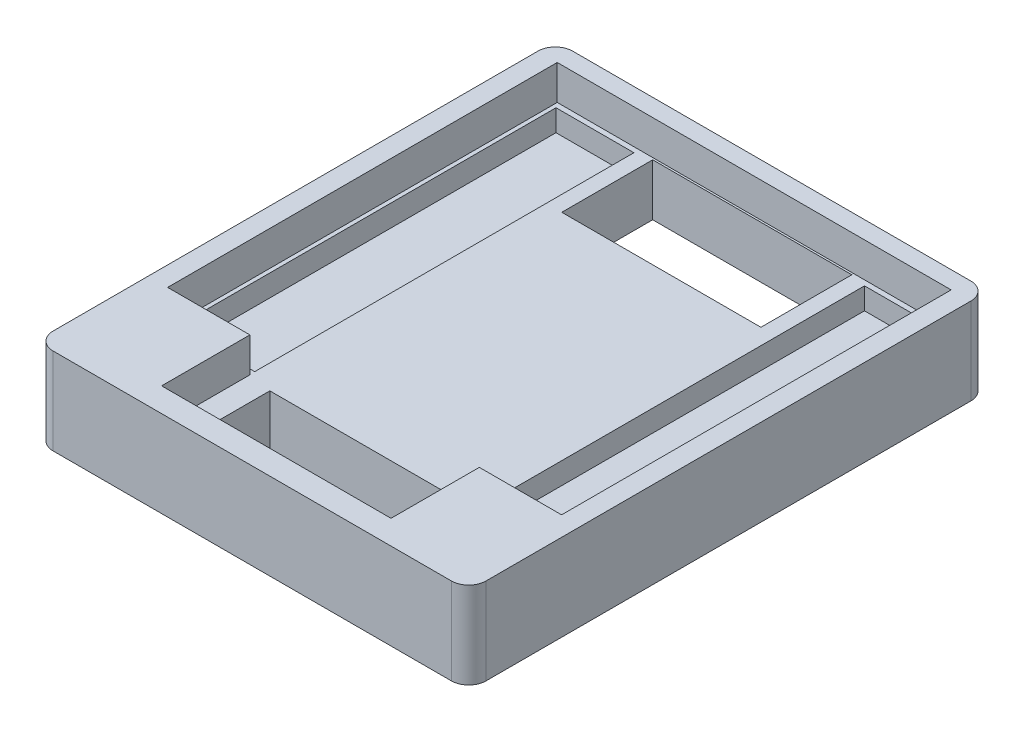
from build123d import *

# Parameters (mm, degrees)
SKETCH1_W           = 50
SKETCH1_H           = 60
BOSS_EXTRUDE1_DEPTH = 10
CUT_EXTRUDE1_DEPTH  = 4
SKETCH3_W           = 23
SKETCH3_H           = 10.5
SKETCH3_W_2         = 21
SKETCH3_H_2         = 8.5
CUT_EXTRUDE2_DEPTH  = 10
SKETCH4_W           = 9
SKETCH4_H           = 43.8
CUT_EXTRUDE3_DEPTH  = 2.5
SKETCH5_W           = 35
SKETCH5_H           = 19
CUT_EXTRUDE4_DEPTH  = 1.5
SKETCH6_W           = 12.3
SKETCH6_H           = 6.8
CUT_EXTRUDE5_DEPTH  = 1.5
FILLET1_R           = 2


with BuildPart() as part:
    # Sketch1 → Boss-Extrude1 (new body)
    with BuildSketch(Plane(origin=(0, 0, 0), x_dir=(1, 0, 0), z_dir=(0, 1, 0))):
        Rectangle(SKETCH1_W, SKETCH1_H)
    extrude(amount=BOSS_EXTRUDE1_DEPTH)

    # Sketch2 → Cut-Extrude1 (cut)
    with BuildSketch(Plane(origin=(0, 10, 0), x_dir=(1, 0, 0), z_dir=(0, 1, 0))):
        Polygon((-22.75, 27.975), (22.75, 27.975), (22.75, -17.025), (13.25, -17.025), (13.25, -27.22), (-13.25, -27.22), (-13.25, -17.025), (-22.75, -17.025), align=None)
    extrude(amount=-CUT_EXTRUDE1_DEPTH, mode=Mode.SUBTRACT)

    # Sketch3 → Cut-Extrude2 (cut)
    with BuildSketch(Plane.XZ):
        with Locations((0, -22.5)):
            Rectangle(SKETCH3_W, SKETCH3_H)
        with Locations((0, 21.72)):
            Rectangle(SKETCH3_W_2, SKETCH3_H_2)
    extrude(amount=-CUT_EXTRUDE2_DEPTH, mode=Mode.SUBTRACT)

    # Sketch4 → Cut-Extrude3 (cut)
    with BuildSketch(Plane(origin=(0, 6, 0), x_dir=(1, 0, 0), z_dir=(0, 1, 0))):
        with Locations((-17.793551609, 5.475)):
            Rectangle(SKETCH4_W, SKETCH4_H)
        with Locations((17.838749051, 5.475)):
            Rectangle(SKETCH4_W, SKETCH4_H)
    extrude(amount=-CUT_EXTRUDE3_DEPTH, mode=Mode.SUBTRACT)

    # Sketch5 → Cut-Extrude4 (cut)
    with BuildSketch(Plane.XZ):
        with Locations((0, -6)):
            Rectangle(SKETCH5_W, SKETCH5_H)
    extrude(amount=-CUT_EXTRUDE4_DEPTH, mode=Mode.SUBTRACT)

    # Sketch6 → Cut-Extrude5 (cut)
    with BuildSketch(Plane.XZ):
        with Locations((0, 10)):
            Rectangle(SKETCH6_W, SKETCH6_H)
    extrude(amount=-CUT_EXTRUDE5_DEPTH, mode=Mode.SUBTRACT)

    # Fillet1
    fillet1_edges = [part.edges().sort_by_distance(p)[0] for p in [
        (25, 5, 30),
        (-25, 5, 30),
        (-25, 5, -30),
        (25, 5, -30),
    ]]
    fillet(fillet1_edges, radius=FILLET1_R)


solid = part.part
